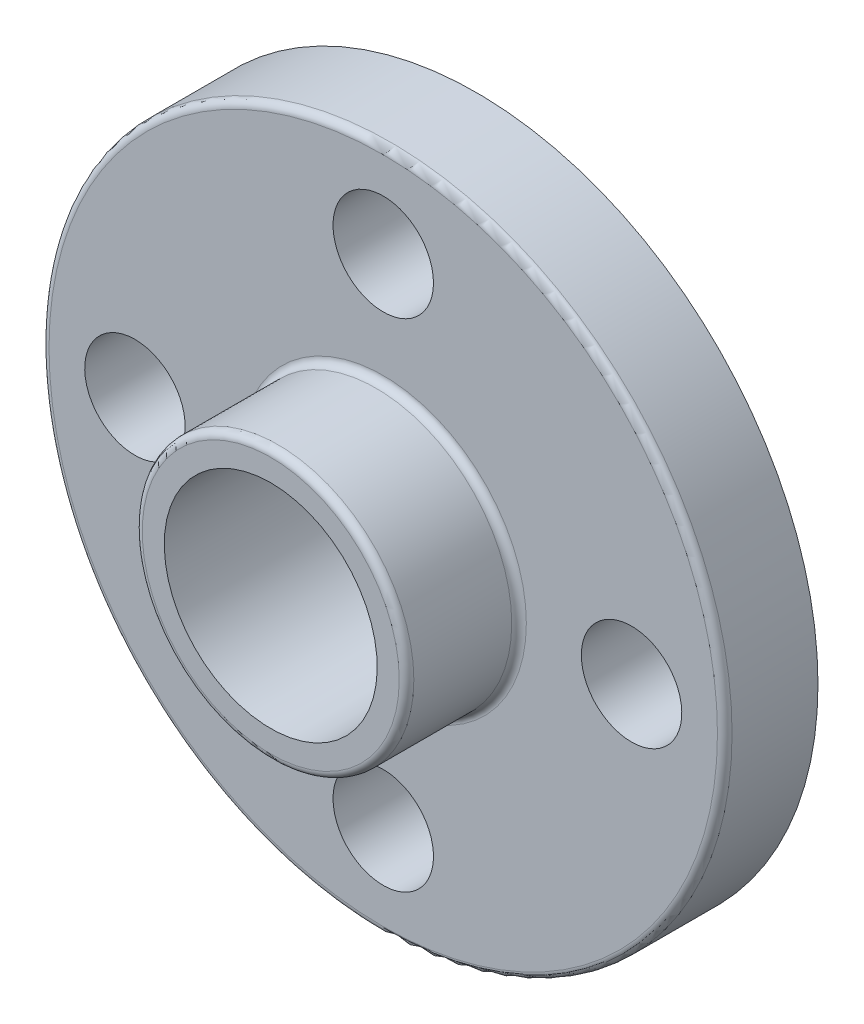
from build123d import *

# Parameters (mm, degrees)
SKETCH1_R         = 53.975
EXTRUDE1_DEPTH    = 14.732
SKETCH2_R         = 21.463
EXTRUDE2_DEPTH    = 17.78
SKETCH3_R         = 7.9375
EXTRUDE3_DEPTH    = 79.375567941
CIRPATTERN1_COUNT = 4
FILLET1_R         = 1.154545455


with BuildPart() as part:
    # Sketch1 → Extrude1 (new body)
    with BuildSketch(Plane.XY):
        Circle(SKETCH1_R)
    extrude(amount=EXTRUDE1_DEPTH)

    # Sketch2 → Extrude2 (add)
    with BuildSketch(Plane.XY.offset(14.732)):
        with Locations(Location((0, 0, 0), (0, 0, 180))):
            Circle(SKETCH2_R)
    extrude(amount=EXTRUDE2_DEPTH)

    # Sketch3 → Extrude3 (cut, through all)
    with BuildSketch(Plane.XY.offset(14.732)):
        with Locations((0, 39.243)):
            Circle(SKETCH3_R)
    extrude3 = extrude(amount=-EXTRUDE3_DEPTH, mode=Mode.SUBTRACT)

    # CirPattern1: Extrude3 ×4 about axis
    cirpattern1_axis = Axis((0, 0, 0), (0, 0, 1))
    for i in range(1, CIRPATTERN1_COUNT):
        add(extrude3.rotate(cirpattern1_axis, i * 360 / CIRPATTERN1_COUNT), mode=Mode.SUBTRACT)

    # Fillet1
    fillet1_edges = [part.edges().sort_by_distance(p)[0] for p in [
        (-53.975, 0, 14.732),
        (21.463, 0, 14.732),
        (21.463, 0, 32.512),
    ]]
    fillet(fillet1_edges, radius=FILLET1_R)

    # Sketch4 → Cut-Revolve1 (revolve, cut)
    with BuildSketch(Plane(origin=(0, 0, 63.5), x_dir=(0, 0, -1), z_dir=(1, 0, 0)), mode=Mode.PRIVATE) as cut_revolve1_sk:
        Polygon((30.988, 16.8275), (59.436, 16.637), (59.436, 12.1539), (63.5, 12.1539), (63.5, 0), (30.988, 0), align=None)
    revolve(cut_revolve1_sk.sketch.rotate(Axis((0, 0, 0), (0, 0, 1)), 270), axis=Axis((0, 0, 0), (0, 0, 1)), mode=Mode.SUBTRACT)


solid = part.part
